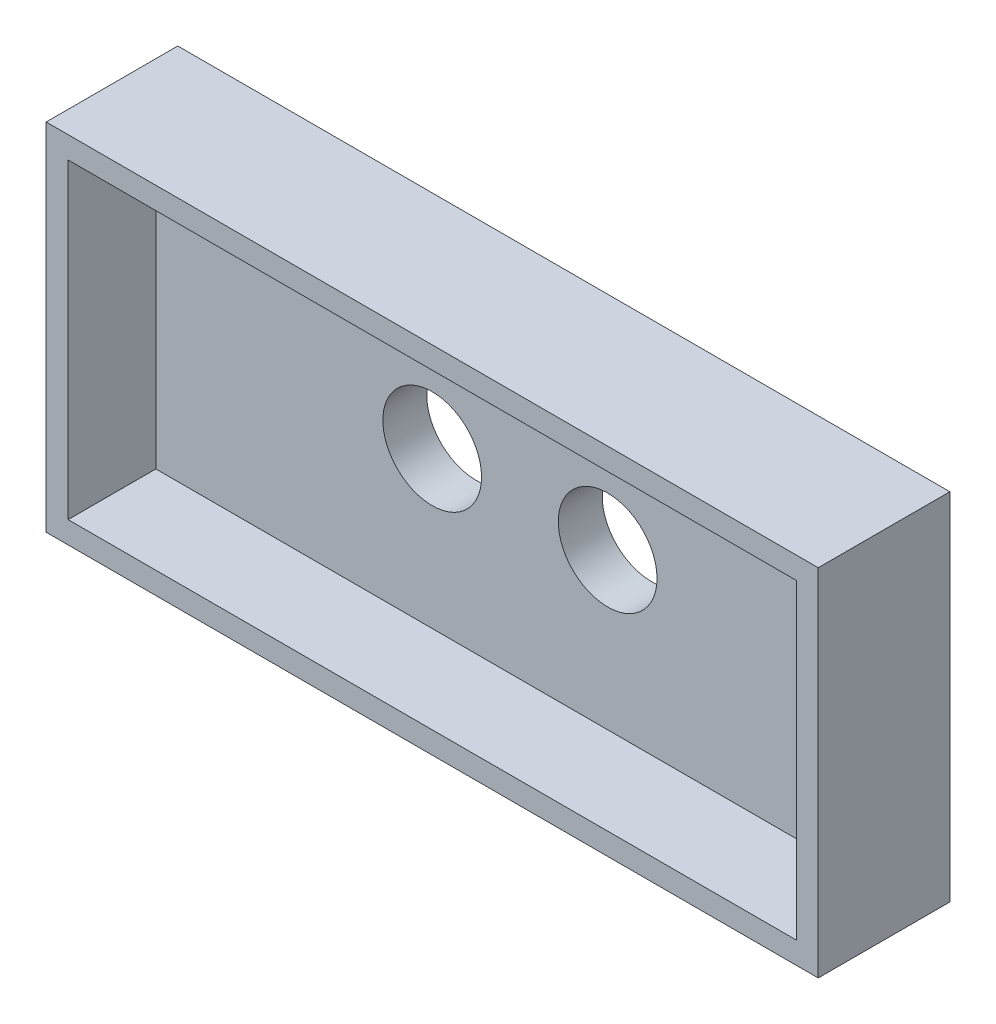
from build123d import *

# Parameters (mm, degrees)
BOSS_EXTRUDE1_DEPTH      = 25.4
BOSS_EXTRUDE1_DEPTH_BACK = 12.7
SKETCH1_W                = 223.52
SKETCH1_H                = 102.87
SKETCH1_W_2              = 210.82
SKETCH1_H_2              = 90.17
SKETCH1_3_W              = 210.82
SKETCH1_3_H              = 90.17
SKETCH1_3_R              = 14.2875
BOSS_EXTRUDE2_DEPTH      = 12.7


with BuildPart() as part:
    # Sketch1 → Boss-Extrude1 (new, two sides: drawn at the far end of the back side and taken through both)
    with BuildSketch(Plane.XY.offset(-BOSS_EXTRUDE1_DEPTH_BACK)):
        Rectangle(SKETCH1_W, SKETCH1_H)
        Rectangle(SKETCH1_W_2, SKETCH1_H_2, mode=Mode.SUBTRACT)
    extrude(amount=BOSS_EXTRUDE1_DEPTH + BOSS_EXTRUDE1_DEPTH_BACK)

    # Sketch1<3> → Boss-Extrude2 (add)
    with BuildSketch(Plane.XY):
        Rectangle(SKETCH1_3_W, SKETCH1_3_H)
        with Locations((-25.4, 0)):
            Circle(SKETCH1_3_R, mode=Mode.SUBTRACT)
        with Locations((25.4, 0)):
            Circle(SKETCH1_3_R, mode=Mode.SUBTRACT)
    extrude(amount=-BOSS_EXTRUDE2_DEPTH)


solid = part.part
